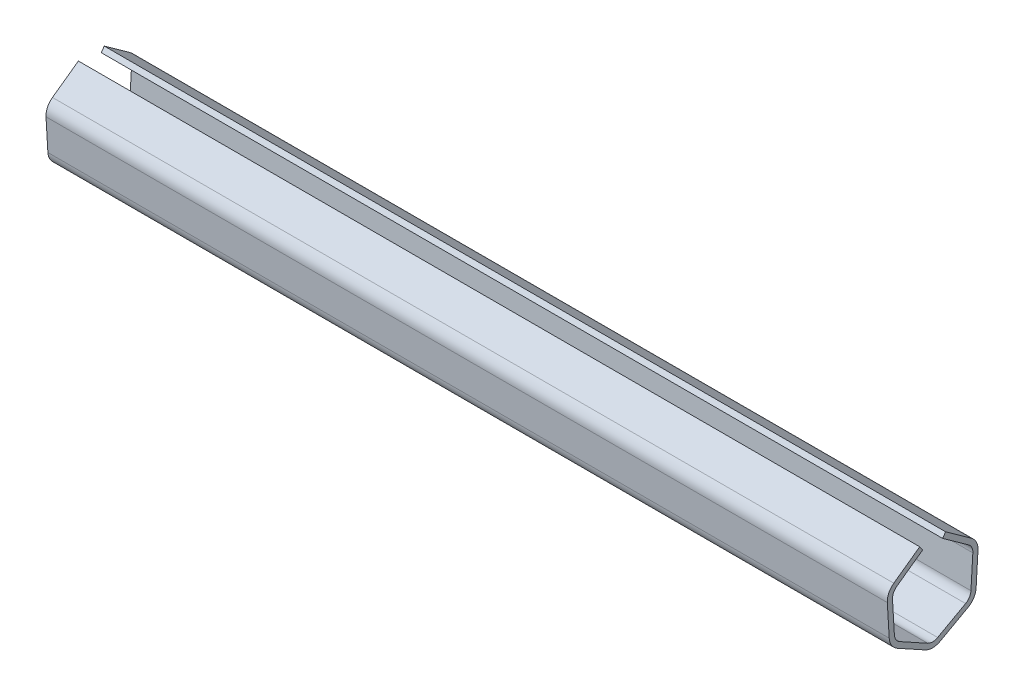
from build123d import *

# Parameters (mm, degrees)
EXTRUDE_THIN1_DEPTH = 325


with BuildPart() as part:
    # Sketch1 → Extrude-Thin1 (new, symmetric)
    with BuildSketch(Plane(origin=(0, 0, 0), x_dir=(0, 0, -1), z_dir=(1, 0, 0))):
        with BuildLine():
            Line((10, 36.492499074), (30.033921668, 22.128857106))
            ThreePointArc((30.033921668, 22.128857106), (33.873815741, 17.540413964), (35.020847295, 11.668198405))
            Line((35.020847295, 11.668198405), (33.565953275, -12.939839131))
            ThreePointArc((33.565953275, -12.939839131), (31.734968696, -18.635986288), (27.381153255, -22.739995068))
            Line((27.381153255, -22.739995068), (5.79428183, -34.642902698))
            ThreePointArc((5.79428183, -34.642902698), (0, -36.134510905), (-5.79428183, -34.642902698))
            Line((-5.79428183, -34.642902698), (-27.381153255, -22.739995068))
            ThreePointArc((-27.381153255, -22.739995068), (-31.734968696, -18.635986288), (-33.565953275, -12.939839131))
            Line((-33.565953275, -12.939839131), (-35.020847295, 11.668198405))
            ThreePointArc((-35.020847295, 11.668198405), (-33.873815741, 17.540413964), (-30.033921668, 22.128857106))
            Line((-30.033921668, 22.128857106), (-10, 36.492499074))
            Line((-10, 36.492499074), (-7.669281259, 33.241691459))
            Line((-7.669281259, 33.241691459), (-27.703202927, 18.878049491))
            ThreePointArc((-27.703202927, 18.878049491), (-30.263132309, 15.819087397), (-31.027820011, 11.904277024))
            Line((-31.027820011, 11.904277024), (-29.572925992, -12.703760512))
            ThreePointArc((-29.572925992, -12.703760512), (-28.352269606, -16.50119195), (-25.449725978, -19.237197803))
            Line((-25.449725978, -19.237197803), (-3.862854553, -31.140105433))
            ThreePointArc((-3.862854553, -31.140105433), (0, -32.134510905), (3.862854553, -31.140105433))
            Line((3.862854553, -31.140105433), (25.449725978, -19.237197803))
            ThreePointArc((25.449725978, -19.237197803), (28.352269606, -16.50119195), (29.572925992, -12.703760512))
            Line((29.572925992, -12.703760512), (31.027820011, 11.904277024))
            ThreePointArc((31.027820011, 11.904277024), (30.263132309, 15.819087397), (27.703202927, 18.878049491))
            Line((27.703202927, 18.878049491), (7.669281259, 33.241691459))
            Line((7.669281259, 33.241691459), (10, 36.492499074))
        make_face()
    extrude(amount=EXTRUDE_THIN1_DEPTH, both=True)


solid = part.part
